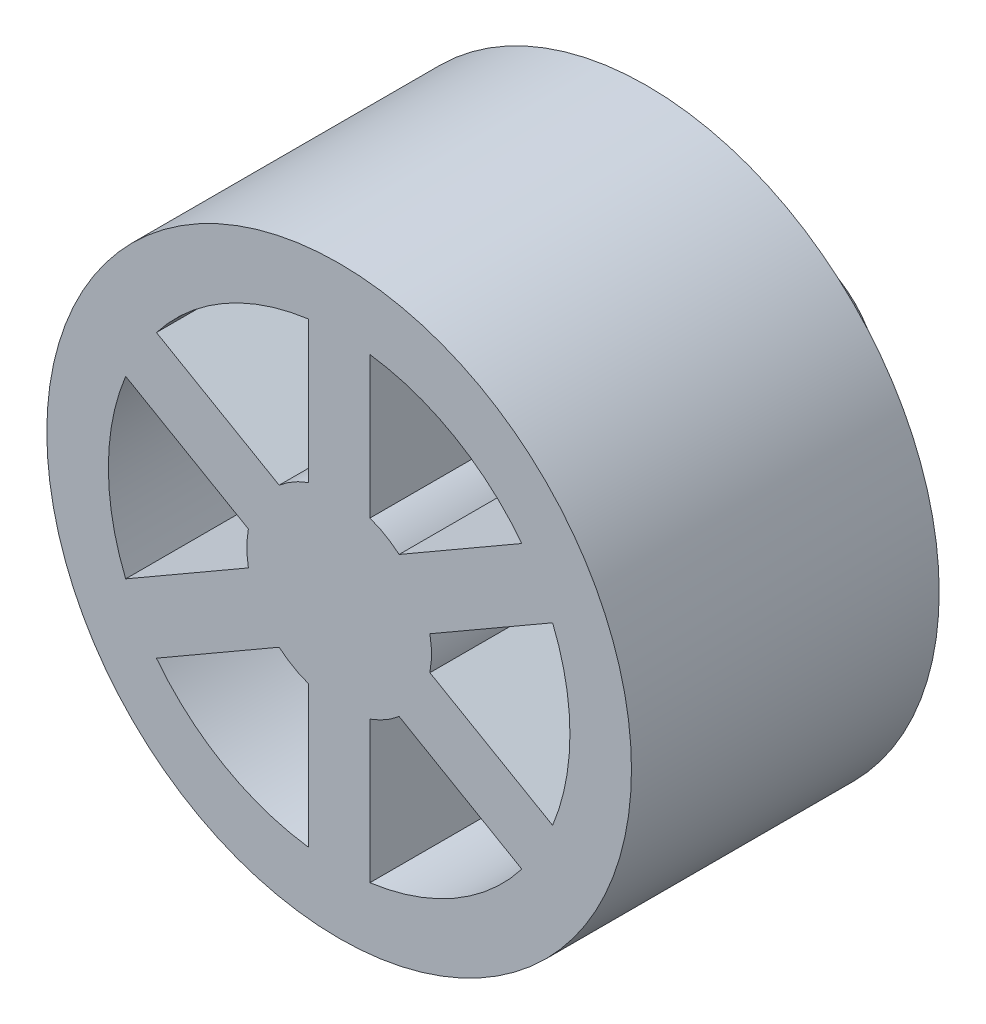
from build123d import *
from build123d.topology import SkipClean

# Parameters (mm, degrees)
SZKIC1_R                    = 9.5
DODANIE_WYCI_GNI_CIE1_DEPTH = 10
DODANIE_WYCI_GNI_CIE2_START = 3.1
SZKIC2_R                    = 3
DODANIE_WYCI_GNI_CIE2_DEPTH = 3.1
ZAOKR_GLENIE1_R             = 1
WYTNIJ_WYCI_GNI_CIE2_REACH  = 22.137


with BuildPart() as part:
    # Szkic1 → Dodanie-wyciągnięcie1 (new body)
    with BuildSketch(Plane.XY):
        Circle(SZKIC1_R)
        with BuildLine():
            Line((-5.937197, -4.582543), (-1.94949, -2.280239))
            ThreePointArc((-1.94949, -2.280239), (-1.5, -2.598076), (-1, -2.828427))
            Line((-1, -2.828427), (-1, -7.433034))
            ThreePointArc((-1, -7.433034), (-3.75, -6.495191), (-5.937197, -4.582543))
        make_face(mode=Mode.SUBTRACT)
        with BuildLine():
            Line((1, -7.433034), (1, -2.828427))
            ThreePointArc((1, -2.828427), (1.5, -2.598076), (1.94949, -2.280239))
            Line((1.94949, -2.280239), (5.937197, -4.582543))
            ThreePointArc((5.937197, -4.582543), (3.75, -6.495191), (1, -7.433034))
        make_face(mode=Mode.SUBTRACT)
        with BuildLine():
            Line((6.937197, -2.850492), (2.94949, -0.548188))
            ThreePointArc((2.94949, -0.548188), (3, 0), (2.94949, 0.548188))
            Line((2.94949, 0.548188), (6.937197, 2.850492))
            ThreePointArc((6.937197, 2.850492), (7.5, 0), (6.937197, -2.850492))
        make_face(mode=Mode.SUBTRACT)
        with BuildLine():
            Line((5.937197, 4.582543), (1.94949, 2.280239))
            ThreePointArc((1.94949, 2.280239), (1.5, 2.598076), (1, 2.828427))
            Line((1, 2.828427), (1, 7.433034))
            ThreePointArc((1, 7.433034), (3.75, 6.495191), (5.937197, 4.582543))
        make_face(mode=Mode.SUBTRACT)
        with BuildLine():
            Line((-1, 7.433034), (-1, 2.828427))
            ThreePointArc((-1, 2.828427), (-1.5, 2.598076), (-1.94949, 2.280239))
            Line((-1.94949, 2.280239), (-5.937197, 4.582543))
            ThreePointArc((-5.937197, 4.582543), (-3.75, 6.495191), (-1, 7.433034))
        make_face(mode=Mode.SUBTRACT)
        with BuildLine():
            Line((-6.937197, 2.850492), (-2.94949, 0.548188))
            ThreePointArc((-2.94949, 0.548188), (-3, 0), (-2.94949, -0.548188))
            Line((-2.94949, -0.548188), (-6.937197, -2.850492))
            ThreePointArc((-6.937197, -2.850492), (-7.5, 0), (-6.937197, 2.850492))
        make_face(mode=Mode.SUBTRACT)
    extrude(amount=DODANIE_WYCI_GNI_CIE1_DEPTH)

    # Szkic2 → Dodanie-wyciągnięcie2 (add)
    with SkipClean():  # the faces are left unmerged after this step: merging them gives an invalid solid
        with BuildSketch(Plane(origin=(0, 0, 0), x_dir=(-1, 0, 0), z_dir=(0, 0, -1)).offset(DODANIE_WYCI_GNI_CIE2_START)):
            Circle(SZKIC2_R)
        extrude(amount=-DODANIE_WYCI_GNI_CIE2_DEPTH)

    # Szkic9 → Obrót1 (revolve)
    with SkipClean():  # the faces are left unmerged after this step: merging them gives an invalid solid
        with BuildSketch(Plane(origin=(0, 0, 0), x_dir=(1, 0, 0), z_dir=(0, 1, 0))):
            Polygon((-3, 3.1), (0, 3.1), (0, 5), (-3, 5), (-3.347733, 3.193175), align=None)
        revolve(axis=Axis((0, 0, -3.1), (0, 0, -1)))

    # Zaokrąglenie1
    zaokr_glenie1_edges = [part.edges().sort_by_distance(p)[0] for p in [
        (3, 0, -5),
    ]]
    fillet(zaokr_glenie1_edges, radius=ZAOKR_GLENIE1_R)

    # Wytnij-wyciągnięcie2: up to this face of the body (flat: up to its plane)
    wytnij_wyci_gni_cie2_end = Plane(part.part.faces().sort_by_distance((-9.231299, 0, 0))[0])
    # Szkic10 → Wytnij-wyciągnięcie2 (cut, up to the picked face)
    with BuildSketch(Plane(origin=(0, 0, -5), x_dir=(-1, 0, 0), z_dir=(0, 0, -1)), mode=Mode.PRIVATE) as wytnij_wyci_gni_cie2_sk1:
        with BuildLine():
            Line((-0.62476, 1.899915), (0, 0))
            Line((0, 0), (0.625267, 1.899748))
            ThreePointArc((0.625267, 1.899748), (0.000267, 2), (-0.62476, 1.899915))
        make_face()
    wytnij_wyci_gni_cie2_tool1 = split(extrude(wytnij_wyci_gni_cie2_sk1.sketch, amount=-WYTNIJ_WYCI_GNI_CIE2_REACH, mode=Mode.PRIVATE), bisect_by=wytnij_wyci_gni_cie2_end, keep=Keep.BOTH, mode=Mode.PRIVATE)
    # Szkic10 → Wytnij-wyciągnięcie2 (cut, up to the picked face)
    with BuildSketch(Plane(origin=(0, 0, -5), x_dir=(-1, 0, 0), z_dir=(0, 0, -1)), mode=Mode.PRIVATE) as wytnij_wyci_gni_cie2_sk2:
        with BuildLine():
            Line((-1.899748, 0.625267), (0, 0))
            Line((0, 0), (-0.62476, 1.899915))
            ThreePointArc((-0.62476, 1.899915), (-1.414025, 1.414402), (-1.899748, 0.625267))
        make_face()
    wytnij_wyci_gni_cie2_tool2 = split(extrude(wytnij_wyci_gni_cie2_sk2.sketch, amount=-WYTNIJ_WYCI_GNI_CIE2_REACH, mode=Mode.PRIVATE), bisect_by=wytnij_wyci_gni_cie2_end, keep=Keep.BOTH, mode=Mode.PRIVATE)
    # Szkic10 → Wytnij-wyciągnięcie2 (cut, up to the picked face)
    with BuildSketch(Plane(origin=(0, 0, -5), x_dir=(-1, 0, 0), z_dir=(0, 0, -1)), mode=Mode.PRIVATE) as wytnij_wyci_gni_cie2_sk3:
        with BuildLine():
            Line((1.899915, 0.62476), (0, 0))
            Line((0, 0), (1.899748, -0.625267))
            ThreePointArc((1.899748, -0.625267), (1.974778, -0.316627), (2, 0))
            ThreePointArc((2, 0), (1.97482, 0.316363), (1.899915, 0.62476))
        make_face()
    wytnij_wyci_gni_cie2_tool3 = split(extrude(wytnij_wyci_gni_cie2_sk3.sketch, amount=-WYTNIJ_WYCI_GNI_CIE2_REACH, mode=Mode.PRIVATE), bisect_by=wytnij_wyci_gni_cie2_end, keep=Keep.BOTH, mode=Mode.PRIVATE)
    # Szkic10 → Wytnij-wyciągnięcie2 (cut, up to the picked face)
    with BuildSketch(Plane(origin=(0, 0, -5), x_dir=(-1, 0, 0), z_dir=(0, 0, -1)), mode=Mode.PRIVATE) as wytnij_wyci_gni_cie2_sk4:
        with BuildLine():
            Line((0.625267, 1.899748), (0, 0))
            Line((0, 0), (1.899915, 0.62476))
            ThreePointArc((1.899915, 0.62476), (1.414402, 1.414025), (0.625267, 1.899748))
        make_face()
    wytnij_wyci_gni_cie2_tool4 = split(extrude(wytnij_wyci_gni_cie2_sk4.sketch, amount=-WYTNIJ_WYCI_GNI_CIE2_REACH, mode=Mode.PRIVATE), bisect_by=wytnij_wyci_gni_cie2_end, keep=Keep.BOTH, mode=Mode.PRIVATE)
    # Szkic10 → Wytnij-wyciągnięcie2 (cut, up to the picked face)
    with BuildSketch(Plane(origin=(0, 0, -5), x_dir=(-1, 0, 0), z_dir=(0, 0, -1)), mode=Mode.PRIVATE) as wytnij_wyci_gni_cie2_sk5:
        with BuildLine():
            Line((0.62476, -1.899915), (0, 0))
            Line((0, 0), (-0.625267, -1.899748))
            ThreePointArc((-0.625267, -1.899748), (-0.000267, -2), (0.62476, -1.899915))
        make_face()
    wytnij_wyci_gni_cie2_tool5 = split(extrude(wytnij_wyci_gni_cie2_sk5.sketch, amount=-WYTNIJ_WYCI_GNI_CIE2_REACH, mode=Mode.PRIVATE), bisect_by=wytnij_wyci_gni_cie2_end, keep=Keep.BOTH, mode=Mode.PRIVATE)
    # Szkic10 → Wytnij-wyciągnięcie2 (cut, up to the picked face)
    with BuildSketch(Plane(origin=(0, 0, -5), x_dir=(-1, 0, 0), z_dir=(0, 0, -1)), mode=Mode.PRIVATE) as wytnij_wyci_gni_cie2_sk6:
        with BuildLine():
            Line((1.899748, -0.625267), (0, 0))
            Line((0, 0), (0.62476, -1.899915))
            ThreePointArc((0.62476, -1.899915), (1.414025, -1.414402), (1.899748, -0.625267))
        make_face()
    wytnij_wyci_gni_cie2_tool6 = split(extrude(wytnij_wyci_gni_cie2_sk6.sketch, amount=-WYTNIJ_WYCI_GNI_CIE2_REACH, mode=Mode.PRIVATE), bisect_by=wytnij_wyci_gni_cie2_end, keep=Keep.BOTH, mode=Mode.PRIVATE)
    # Szkic10 → Wytnij-wyciągnięcie2 (cut, up to the picked face)
    with BuildSketch(Plane(origin=(0, 0, -5), x_dir=(-1, 0, 0), z_dir=(0, 0, -1)), mode=Mode.PRIVATE) as wytnij_wyci_gni_cie2_sk7:
        with BuildLine():
            Line((-1.899915, -0.62476), (0, 0))
            Line((0, 0), (-1.899748, 0.625267))
            ThreePointArc((-1.899748, 0.625267), (-2, 0.000267), (-1.899915, -0.62476))
        make_face()
    wytnij_wyci_gni_cie2_tool7 = split(extrude(wytnij_wyci_gni_cie2_sk7.sketch, amount=-WYTNIJ_WYCI_GNI_CIE2_REACH, mode=Mode.PRIVATE), bisect_by=wytnij_wyci_gni_cie2_end, keep=Keep.BOTH, mode=Mode.PRIVATE)
    # Szkic10 → Wytnij-wyciągnięcie2 (cut, up to the picked face)
    with BuildSketch(Plane(origin=(0, 0, -5), x_dir=(-1, 0, 0), z_dir=(0, 0, -1)), mode=Mode.PRIVATE) as wytnij_wyci_gni_cie2_sk8:
        with BuildLine():
            Line((-0.625267, -1.899748), (0, 0))
            Line((0, 0), (-1.899915, -0.62476))
            ThreePointArc((-1.899915, -0.62476), (-1.414402, -1.414025), (-0.625267, -1.899748))
        make_face()
    wytnij_wyci_gni_cie2_tool8 = split(extrude(wytnij_wyci_gni_cie2_sk8.sketch, amount=-WYTNIJ_WYCI_GNI_CIE2_REACH, mode=Mode.PRIVATE), bisect_by=wytnij_wyci_gni_cie2_end, keep=Keep.BOTH, mode=Mode.PRIVATE)
    # Szkic10 → Wytnij-wyciągnięcie2 (cut, up to the picked face)
    with BuildSketch(Plane(origin=(0, 0, -5), x_dir=(-1, 0, 0), z_dir=(0, 0, -1)), mode=Mode.PRIVATE) as wytnij_wyci_gni_cie2_sk9:
        with BuildLine():
            ThreePointArc((-0.62476, 1.899915), (0.000267, 2), (0.625267, 1.899748))
            Line((0.625267, 1.899748), (1.735269, 5.272263))
            Line((1.735269, 5.272263), (-1.733708, 5.272263))
            Line((-1.733708, 5.272263), (-0.62476, 1.899915))
        make_face()
    wytnij_wyci_gni_cie2_tool9 = split(extrude(wytnij_wyci_gni_cie2_sk9.sketch, amount=-WYTNIJ_WYCI_GNI_CIE2_REACH, mode=Mode.PRIVATE), bisect_by=wytnij_wyci_gni_cie2_end, keep=Keep.BOTH, mode=Mode.PRIVATE)
    # Szkic10 → Wytnij-wyciągnięcie2 (cut, up to the picked face)
    with BuildSketch(Plane(origin=(0, 0, -5), x_dir=(-1, 0, 0), z_dir=(0, 0, -1)), mode=Mode.PRIVATE) as wytnij_wyci_gni_cie2_sk10:
        with BuildLine():
            ThreePointArc((2, 0), (1.974778, -0.316627), (1.899748, -0.625267))
            Line((1.899748, -0.625267), (5.272263, -1.735269))
            Line((5.272263, -1.735269), (5.272263, 1.733708))
            Line((5.272263, 1.733708), (1.899915, 0.62476))
            ThreePointArc((1.899915, 0.62476), (1.97482, 0.316363), (2, 0))
        make_face()
    wytnij_wyci_gni_cie2_tool10 = split(extrude(wytnij_wyci_gni_cie2_sk10.sketch, amount=-WYTNIJ_WYCI_GNI_CIE2_REACH, mode=Mode.PRIVATE), bisect_by=wytnij_wyci_gni_cie2_end, keep=Keep.BOTH, mode=Mode.PRIVATE)
    # Szkic10 → Wytnij-wyciągnięcie2 (cut, up to the picked face)
    with BuildSketch(Plane(origin=(0, 0, -5), x_dir=(-1, 0, 0), z_dir=(0, 0, -1)), mode=Mode.PRIVATE) as wytnij_wyci_gni_cie2_sk11:
        with BuildLine():
            ThreePointArc((0.62476, -1.899915), (-0.000267, -2), (-0.625267, -1.899748))
            Line((-0.625267, -1.899748), (-1.735269, -5.272263))
            Line((-1.735269, -5.272263), (1.733708, -5.272263))
            Line((1.733708, -5.272263), (0.62476, -1.899915))
        make_face()
    wytnij_wyci_gni_cie2_tool11 = split(extrude(wytnij_wyci_gni_cie2_sk11.sketch, amount=-WYTNIJ_WYCI_GNI_CIE2_REACH, mode=Mode.PRIVATE), bisect_by=wytnij_wyci_gni_cie2_end, keep=Keep.BOTH, mode=Mode.PRIVATE)
    # Szkic10 → Wytnij-wyciągnięcie2 (cut, up to the picked face)
    with BuildSketch(Plane(origin=(0, 0, -5), x_dir=(-1, 0, 0), z_dir=(0, 0, -1)), mode=Mode.PRIVATE) as wytnij_wyci_gni_cie2_sk12:
        with BuildLine():
            ThreePointArc((-1.899915, -0.62476), (-2, 0.000267), (-1.899748, 0.625267))
            Line((-1.899748, 0.625267), (-5.272263, 1.735269))
            Line((-5.272263, 1.735269), (-5.272263, -1.733708))
            Line((-5.272263, -1.733708), (-1.899915, -0.62476))
        make_face()
    wytnij_wyci_gni_cie2_tool12 = split(extrude(wytnij_wyci_gni_cie2_sk12.sketch, amount=-WYTNIJ_WYCI_GNI_CIE2_REACH, mode=Mode.PRIVATE), bisect_by=wytnij_wyci_gni_cie2_end, keep=Keep.BOTH, mode=Mode.PRIVATE)
    add(wytnij_wyci_gni_cie2_tool1.solids().sort_by(Axis((-0.000175, 1.310998, -5), (0, 0, 1)))[0], mode=Mode.SUBTRACT)
    add(wytnij_wyci_gni_cie2_tool2.solids().sort_by(Axis((0.908708, 0.908951, -5), (0, 0, 1)))[0], mode=Mode.SUBTRACT)
    add(wytnij_wyci_gni_cie2_tool3.solids().sort_by(Axis((-1.310998, -0.000175, -5), (0, 0, 1)))[0], mode=Mode.SUBTRACT)
    add(wytnij_wyci_gni_cie2_tool4.solids().sort_by(Axis((-0.908951, 0.908708, -5), (0, 0, 1)))[0], mode=Mode.SUBTRACT)
    add(wytnij_wyci_gni_cie2_tool5.solids().sort_by(Axis((0.000175, -1.310998, -5), (0, 0, 1)))[0], mode=Mode.SUBTRACT)
    add(wytnij_wyci_gni_cie2_tool6.solids().sort_by(Axis((-0.908708, -0.908951, -5), (0, 0, 1)))[0], mode=Mode.SUBTRACT)
    add(wytnij_wyci_gni_cie2_tool7.solids().sort_by(Axis((1.310998, 0.000175, -5), (0, 0, 1)))[0], mode=Mode.SUBTRACT)
    add(wytnij_wyci_gni_cie2_tool8.solids().sort_by(Axis((0.908951, -0.908708, -5), (0, 0, 1)))[0], mode=Mode.SUBTRACT)
    add(wytnij_wyci_gni_cie2_tool9.solids().sort_by(Axis((-0.000576, 3.8707, -5), (0, 0, 1)))[0], mode=Mode.SUBTRACT)
    add(wytnij_wyci_gni_cie2_tool10.solids().sort_by(Axis((-3.8707, -0.000576, -5), (0, 0, 1)))[0], mode=Mode.SUBTRACT)
    add(wytnij_wyci_gni_cie2_tool11.solids().sort_by(Axis((0.000576, -3.8707, -5), (0, 0, 1)))[0], mode=Mode.SUBTRACT)
    add(wytnij_wyci_gni_cie2_tool12.solids().sort_by(Axis((3.8707, 0.000576, -5), (0, 0, 1)))[0], mode=Mode.SUBTRACT)


solid = part.part
